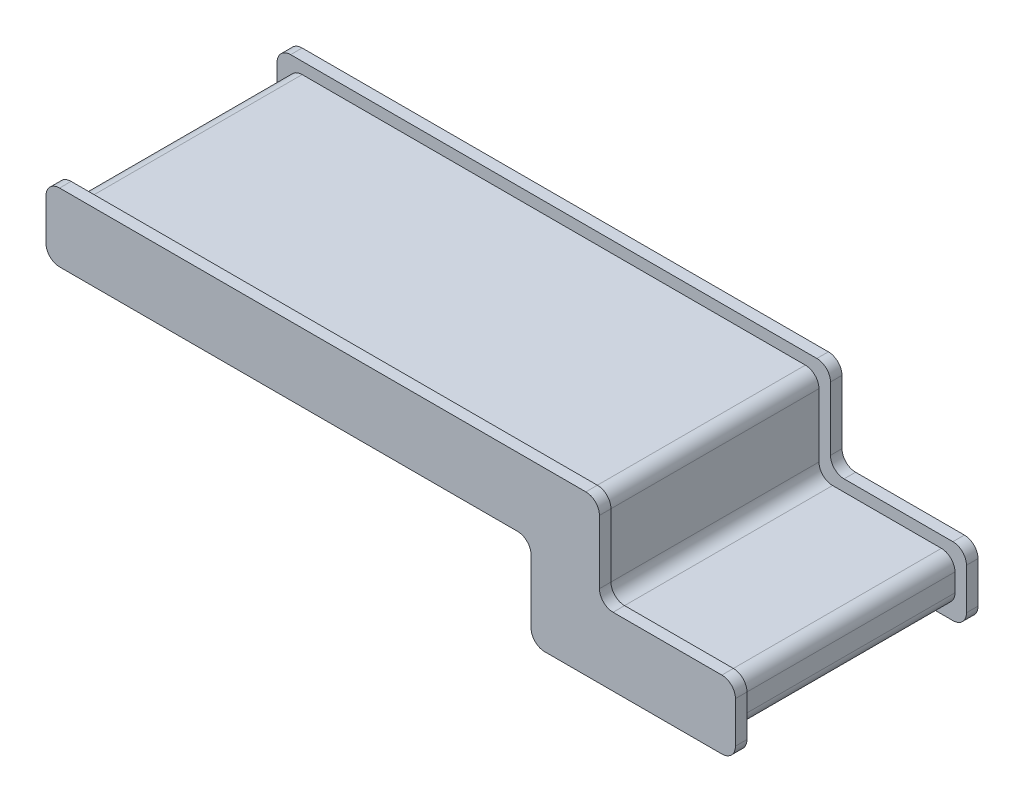
from build123d import *

# Parameters (mm, degrees)
SKETCH2_W           = 107
SKETCH2_H           = 10
BOSS_EXTRUDE1_DEPTH = 48.42
BOSS_EXTRUDE2_DEPTH = 48.42
BOSS_EXTRUDE3_DEPTH = 2.54
BOSS_EXTRUDE4_DEPTH = 2.54
FILLET1_R           = 3


with BuildPart() as part:
    # Sketch2 → Boss-Extrude1 (new body)
    with BuildSketch(Plane.XY):
        with Locations((53.5, 5)):
            Rectangle(SKETCH2_W, SKETCH2_H)
    extrude(amount=BOSS_EXTRUDE1_DEPTH)

    # Sketch3 → Boss-Extrude2 (add)
    with BuildSketch(Plane.XY.offset(48.42)):
        Polygon((107, 10), (117, 10), (117, -10), (147, -10), (147, -20), (117, -20), (107, -20), align=None)
    extrude(amount=-BOSS_EXTRUDE2_DEPTH)

    # Sketch4 → Boss-Extrude3 (add)
    with BuildSketch(Plane.XY.offset(48.42)):
        Polygon((-2.54, 12.54), (119.54, 12.54), (119.54, -7.46), (149.54, -7.46), (149.54, -22.54), (104.46, -22.54), (104.46, -2.54), (-2.54, -2.54), align=None)
    extrude(amount=BOSS_EXTRUDE3_DEPTH)

    # Sketch5 → Boss-Extrude4 (add)
    with BuildSketch(Plane(origin=(0, 0, 0), x_dir=(-1, 0, 0), z_dir=(0, 0, -1))):
        Polygon((-119.54, 12.54), (-119.54, -7.46), (-149.54, -7.46), (-149.54, -22.54), (-104.46, -22.54), (-104.46, -2.54), (2.54, -2.54), (2.54, 12.54), align=None)
    extrude(amount=BOSS_EXTRUDE4_DEPTH)

    # Fillet1
    fillet1_edges = [part.edges().sort_by_distance(p)[0] for p in [
        (107, -20, 24.21),
        (117, 10, 24.21),
        (117, -10, 24.21),
        (147, -10, 24.21),
        (147, -20, 24.21),
        (-2.54, 12.54, 49.69),
        (-2.54, -2.54, 49.69),
        (104.46, -2.54, 49.69),
        (104.46, -22.54, 49.69),
        (149.54, -22.54, 49.69),
        (149.54, -7.46, 49.69),
        (119.54, -7.46, 49.69),
        (119.54, 12.54, 49.69),
        (149.54, -7.46, -1.27),
        (149.54, -22.54, -1.27),
        (104.46, -22.54, -1.27),
        (104.46, -2.54, -1.27),
        (-2.54, -2.54, -1.27),
        (-2.54, 12.54, -1.27),
        (119.54, 12.54, -1.27),
        (119.54, -7.46, -1.27),
        (0, 10, 24.21),
        (107, 0, 24.21),
    ]]
    fillet(fillet1_edges, radius=FILLET1_R)


solid = part.part
